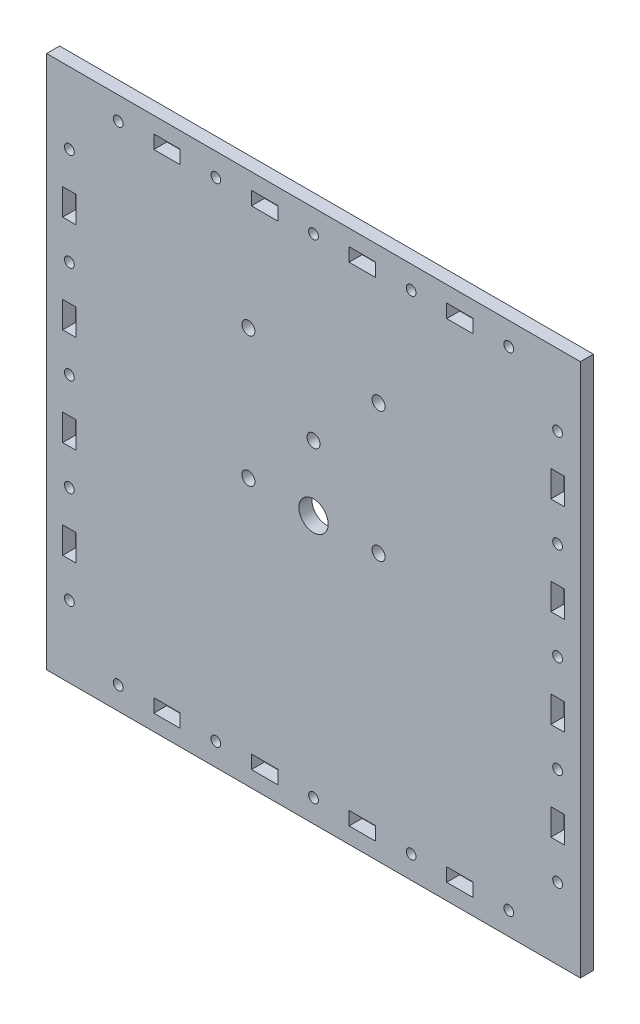
from build123d import *

# Parameters (mm, degrees)
SKETCH_1_W      = 164
SKETCH_1_H      = 164
SKETCH_1_R      = 1.5
SKETCH_1_R_2    = 4.5
SKETCH_1_R_3    = 2
SKETCH_1_W_2    = 8.12
SKETCH_1_H_2    = 4.129008776
SKETCH_1_W_3    = 4.129008777
SKETCH_1_H_3    = 8.12
EXTRUDE_1_DEPTH = 4


with BuildPart() as part:
    # 草图1 → 凸台-拉伸1 (new body)
    with BuildSketch(Plane.XY):
        with Locations((47.027428163, 15.054738201)):
            Rectangle(SKETCH_1_W, SKETCH_1_H)
        with Locations((47.027428163, 90.054738201)):
            Circle(SKETCH_1_R, mode=Mode.SUBTRACT)
        with Locations((47.027428163, 15.054738201)):
            Circle(SKETCH_1_R_2, mode=Mode.SUBTRACT)
        with Locations((77.027428163, 90.054738201)):
            Circle(SKETCH_1_R, mode=Mode.SUBTRACT)
        with Locations((107.027428163, 90.054738201)):
            Circle(SKETCH_1_R, mode=Mode.SUBTRACT)
        with Locations((-12.972571837, 90.054738201)):
            Circle(SKETCH_1_R, mode=Mode.SUBTRACT)
        with Locations((67.027428163, 15.054738201)):
            Circle(SKETCH_1_R_3, mode=Mode.SUBTRACT)
        with Locations((17.027428163, 90.054738201)):
            Circle(SKETCH_1_R, mode=Mode.SUBTRACT)
        with Locations((122.027428163, 15.054738201)):
            Circle(SKETCH_1_R, mode=Mode.SUBTRACT)
        with Locations((122.027428163, -14.945261799)):
            Circle(SKETCH_1_R, mode=Mode.SUBTRACT)
        with Locations((122.027428163, -44.945261799)):
            Circle(SKETCH_1_R, mode=Mode.SUBTRACT)
        with Locations((122.027428163, 75.054738201)):
            Circle(SKETCH_1_R, mode=Mode.SUBTRACT)
        with Locations((67.027428163, 55.054738201)):
            Circle(SKETCH_1_R_3, mode=Mode.SUBTRACT)
        with Locations((122.027428163, 45.054738201)):
            Circle(SKETCH_1_R, mode=Mode.SUBTRACT)
        with Locations((47.027428163, -59.945261799)):
            Circle(SKETCH_1_R, mode=Mode.SUBTRACT)
        with Locations((17.027428163, -59.945261799)):
            Circle(SKETCH_1_R, mode=Mode.SUBTRACT)
        with Locations((-12.972571837, -59.945261799)):
            Circle(SKETCH_1_R, mode=Mode.SUBTRACT)
        with Locations((107.027428163, -59.945261799)):
            Circle(SKETCH_1_R, mode=Mode.SUBTRACT)
        with Locations((77.027428163, -59.945261799)):
            Circle(SKETCH_1_R, mode=Mode.SUBTRACT)
        with Locations((-27.972571837, 15.054738201)):
            Circle(SKETCH_1_R, mode=Mode.SUBTRACT)
        with Locations((-27.972571837, 45.054738201)):
            Circle(SKETCH_1_R, mode=Mode.SUBTRACT)
        with Locations((-27.972571837, 75.054738201)):
            Circle(SKETCH_1_R, mode=Mode.SUBTRACT)
        with Locations((-27.972571837, -44.945261799)):
            Circle(SKETCH_1_R, mode=Mode.SUBTRACT)
        with Locations((-27.972571837, -14.945261799)):
            Circle(SKETCH_1_R, mode=Mode.SUBTRACT)
        with Locations((27.027428163, 55.054738201)):
            Circle(SKETCH_1_R_3, mode=Mode.SUBTRACT)
        with Locations((27.027428163, 15.054738201)):
            Circle(SKETCH_1_R_3, mode=Mode.SUBTRACT)
        with Locations((47.027428163, 35.054738201)):
            Circle(SKETCH_1_R_3, mode=Mode.SUBTRACT)
        with Locations((62.027428163, 90.054738201)):
            Rectangle(SKETCH_1_W_2, SKETCH_1_H_2, mode=Mode.SUBTRACT)
        with Locations((92.027428163, 90.054738201)):
            Rectangle(SKETCH_1_W_2, SKETCH_1_H_2, mode=Mode.SUBTRACT)
        with Locations((2.027428163, 90.054738201)):
            Rectangle(SKETCH_1_W_2, SKETCH_1_H_2, mode=Mode.SUBTRACT)
        with Locations((32.027428163, 90.054738201)):
            Rectangle(SKETCH_1_W_2, SKETCH_1_H_2, mode=Mode.SUBTRACT)
        with Locations((122.027428164, 0.054738201)):
            Rectangle(SKETCH_1_W_3, SKETCH_1_H_3, mode=Mode.SUBTRACT)
        with Locations((122.027428164, -29.945261799)):
            Rectangle(SKETCH_1_W_3, SKETCH_1_H_3, mode=Mode.SUBTRACT)
        with Locations((122.027428164, 60.054738201)):
            Rectangle(SKETCH_1_W_3, SKETCH_1_H_3, mode=Mode.SUBTRACT)
        with Locations((122.027428164, 30.054738201)):
            Rectangle(SKETCH_1_W_3, SKETCH_1_H_3, mode=Mode.SUBTRACT)
        with Locations((32.027428163, -59.945261799)):
            Rectangle(SKETCH_1_W_2, SKETCH_1_H_2, mode=Mode.SUBTRACT)
        with Locations((2.027428163, -59.945261799)):
            Rectangle(SKETCH_1_W_2, SKETCH_1_H_2, mode=Mode.SUBTRACT)
        with Locations((92.027428163, -59.945261799)):
            Rectangle(SKETCH_1_W_2, SKETCH_1_H_2, mode=Mode.SUBTRACT)
        with Locations((62.027428163, -59.945261799)):
            Rectangle(SKETCH_1_W_2, SKETCH_1_H_2, mode=Mode.SUBTRACT)
        with Locations((-27.972571837, 30.054738201)):
            Rectangle(SKETCH_1_W_3, SKETCH_1_H_3, mode=Mode.SUBTRACT)
        with Locations((-27.972571837, 60.054738201)):
            Rectangle(SKETCH_1_W_3, SKETCH_1_H_3, mode=Mode.SUBTRACT)
        with Locations((-27.972571837, -29.945261799)):
            Rectangle(SKETCH_1_W_3, SKETCH_1_H_3, mode=Mode.SUBTRACT)
        with Locations((-27.972571837, 0.054738201)):
            Rectangle(SKETCH_1_W_3, SKETCH_1_H_3, mode=Mode.SUBTRACT)
    extrude(amount=EXTRUDE_1_DEPTH)


solid = part.part
